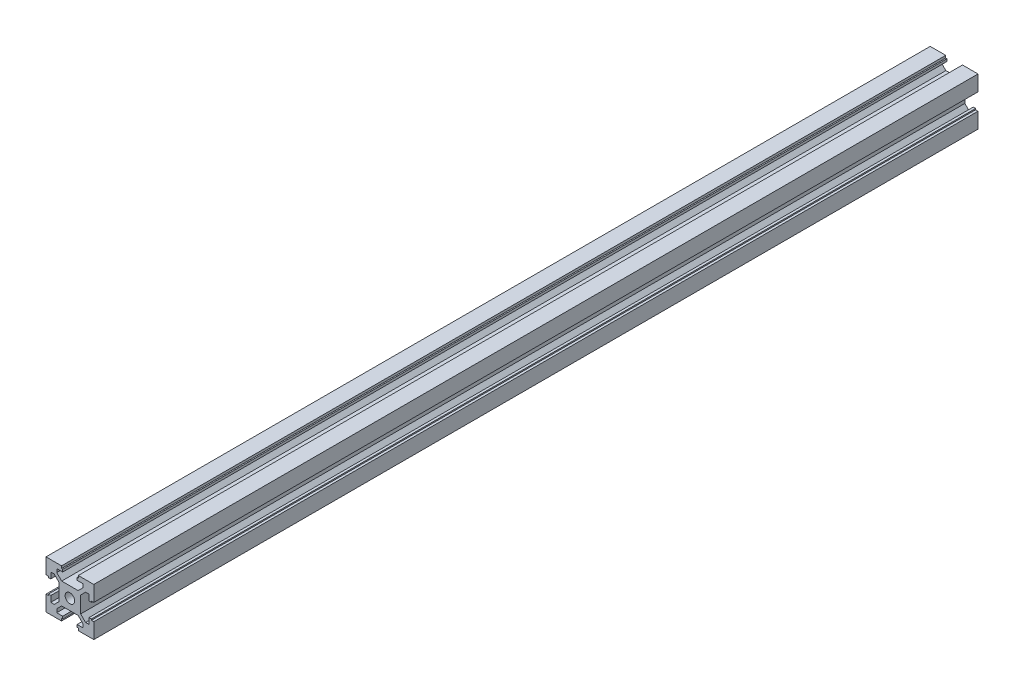
from build123d import *

# Parameters (mm, degrees)
SKETCH1_R           = 2
BOSS_EXTRUDE1_DEPTH = 370
SKETCH2_R           = 2
CUT_EXTRUDE1_DEPTH  = 27
SKETCH3_R           = 2
CUT_EXTRUDE2_DEPTH  = 28


with BuildPart() as part:
    # Sketch1 → Boss-Extrude1 (new body)
    with BuildSketch(Plane.XY):
        Polygon((-10, -10), (-3.5, -10), (-3.5, -9), (-3, -9), (-3, -8), (-5.5, -8), (-5.5, -6.560660172), (-3.44, -4.500660172), (3.44, -4.500660172), (5.5, -6.560660172), (5.5, -8), (3, -8), (3, -9), (3.5, -9), (3.5, -10), (10, -10), (10, -3.5), (9, -3.5), (9, -3), (8, -3), (8, -5.5), (6.560660172, -5.5), (4.500660172, -3.44), (4.500660172, 3.44), (6.560660172, 5.5), (8, 5.5), (8, 3), (9, 3), (9, 3.5), (10, 3.5), (10, 10), (3.5, 10), (3.5, 9), (3, 9), (3, 8), (5.5, 8), (5.5, 6.560660172), (3.44, 4.500660172), (-3.44, 4.500660172), (-5.5, 6.560660172), (-5.5, 8), (-3, 8), (-3, 9), (-3.5, 9), (-3.5, 10), (-10, 10), (-10, 3.5), (-9, 3.5), (-9, 3), (-8, 3), (-8, 5.5), (-6.560660172, 5.5), (-4.500660172, 3.44), (-4.500660172, -3.44), (-6.560660172, -5.5), (-8, -5.5), (-8, -3), (-9, -3), (-9, -3.5), (-10, -3.5), align=None)
        Circle(SKETCH1_R, mode=Mode.SUBTRACT)
    extrude(amount=BOSS_EXTRUDE1_DEPTH)

    # Sketch2 → Cut-Extrude1 (cut)
    with BuildSketch(Plane(origin=(0, 10, 0), x_dir=(1, 0, 0), z_dir=(0, 1, 0))):
        with Locations(Location((0, -15, 0), (0, 0, 270))):
            Circle(SKETCH2_R)
        with Locations(Location((0, -30, 0), (0, 0, 270))):
            Circle(SKETCH2_R)
        with Locations(Location((0, -355, 0), (0, 0, 270))):
            Circle(SKETCH2_R)
        with Locations(Location((0, -340, 0), (0, 0, 270))):
            Circle(SKETCH2_R)
    extrude(amount=-CUT_EXTRUDE1_DEPTH, mode=Mode.SUBTRACT)

    # Sketch3 → Cut-Extrude2 (cut)
    with BuildSketch(Plane.XZ.offset(4.500660172)):
        with Locations(Location((0, 80, 0), (0, 0, 270))):
            Circle(SKETCH3_R)
        with Locations(Location((0, 290, 0), (0, 0, 270))):
            Circle(SKETCH3_R)
    extrude(amount=-CUT_EXTRUDE2_DEPTH, mode=Mode.SUBTRACT)


solid = part.part
